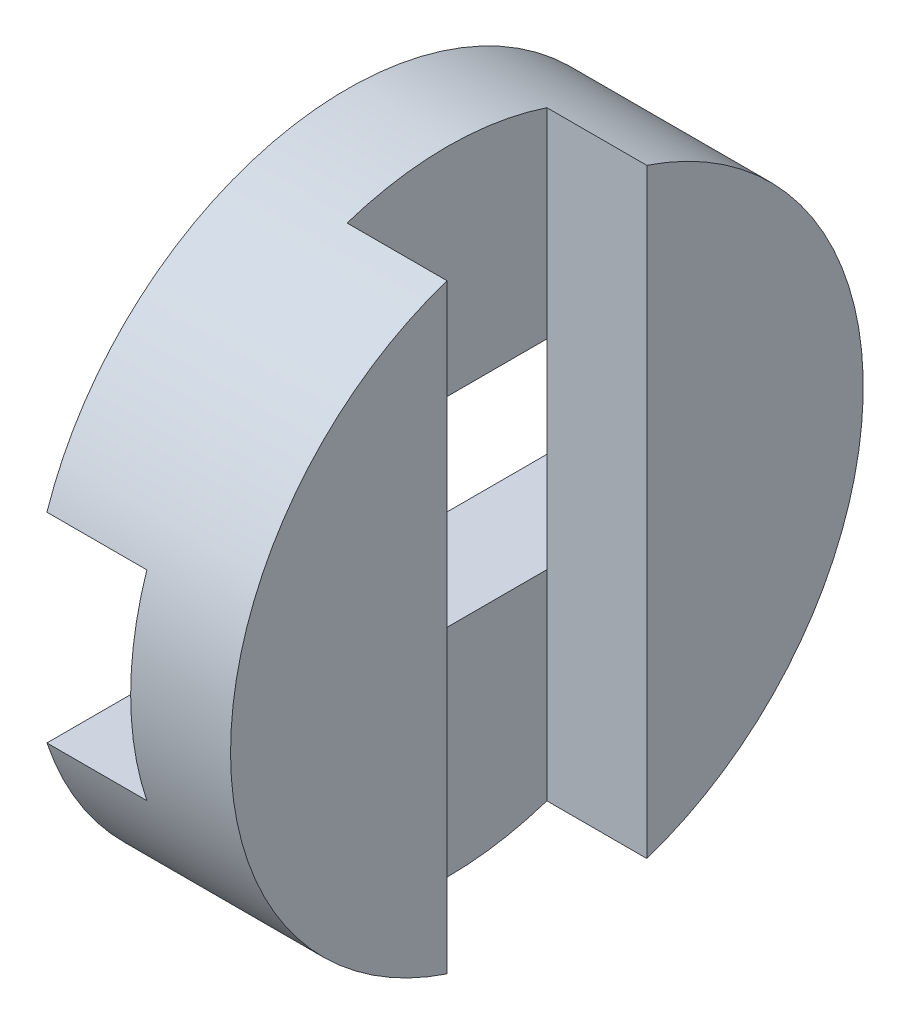
from build123d import *

# Parameters (mm, degrees)
ESQUISSE1_W             = 6
ESQUISSE1_H             = 9.5
ESQUISSE2_W             = 3
ESQUISSE2_H             = 6
ENL_V_MAT_EXTRU_1_DEPTH = 10
ESQUISSE3_W             = 3
ESQUISSE3_H             = 6
ENL_V_MAT_EXTRU_2_DEPTH = 10


with BuildPart() as part:
    # Esquisse1 → Base-Révolution (revolve)
    with BuildSketch(Plane.XY, mode=Mode.PRIVATE) as base_r_volution_sk:
        with Locations((3, 4.75)):
            Rectangle(ESQUISSE1_W, ESQUISSE1_H)
    revolve(base_r_volution_sk.sketch.rotate(Axis((0, 0, 0), (1, 0, 0)), 90), axis=Axis((0, 0, 0), (1, 0, 0)))

    # Esquisse2 → Enlèv. mat.-Extru.1 (cut, symmetric)
    with BuildSketch(Plane.XY):
        with Locations((1.5, 0)):
            Rectangle(ESQUISSE2_W, ESQUISSE2_H)
    extrude(amount=ENL_V_MAT_EXTRU_1_DEPTH, both=True, mode=Mode.SUBTRACT)

    # Esquisse3 → Enlèv. mat.-Extru.2 (cut, symmetric)
    with BuildSketch(Plane(origin=(0, 0, 0), x_dir=(1, 0, 0), z_dir=(0, 1, 0))):
        with Locations((4.5, 0)):
            Rectangle(ESQUISSE3_W, ESQUISSE3_H)
    extrude(amount=ENL_V_MAT_EXTRU_2_DEPTH, both=True, mode=Mode.SUBTRACT)


solid = part.part
